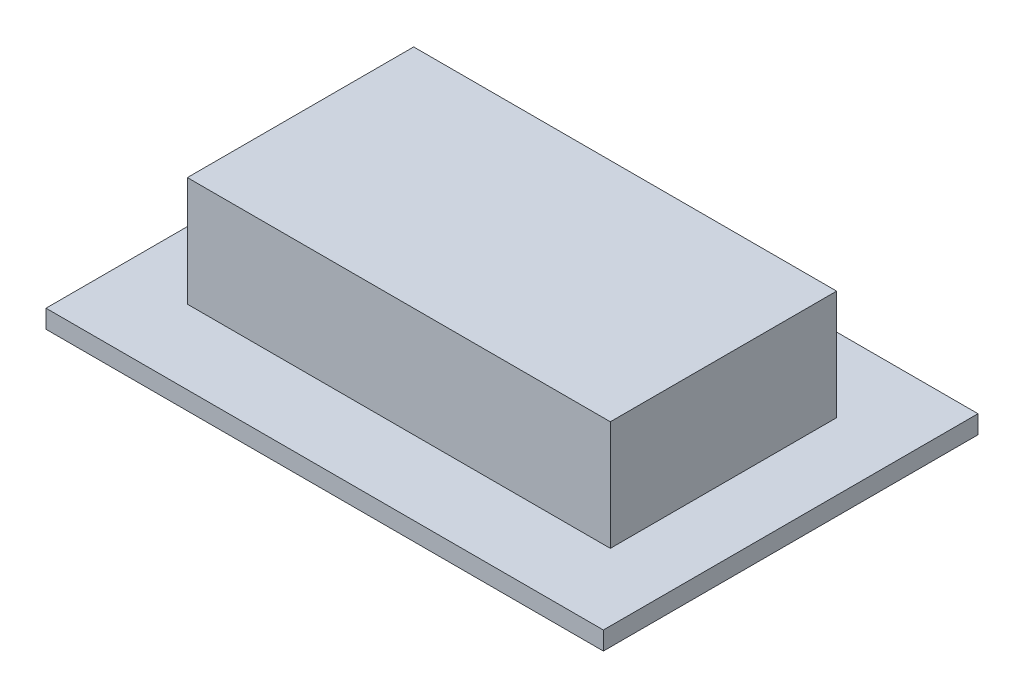
from build123d import *

# Parameters (mm, degrees)
SKETCH1_W           = 61
SKETCH1_H           = 41
BOSS_EXTRUDE1_DEPTH = 2
SKETCH2_W           = 46.288327706
SKETCH2_H           = 24.767077782
BOSS_EXTRUDE2_DEPTH = 12
SKETCH3_W           = 20.528597362
SKETCH3_H           = 14.9402222
BOSS_EXTRUDE3_DEPTH = 12


with BuildPart() as part:
    # Sketch1 → Boss-Extrude1 (new body)
    with BuildSketch(Plane(origin=(0, 0, 0), x_dir=(1, 0, 0), z_dir=(0, 1, 0))):
        Rectangle(SKETCH1_W, SKETCH1_H)
    extrude(amount=BOSS_EXTRUDE1_DEPTH)

    # Sketch2 → Boss-Extrude2 (add)
    with BuildSketch(Plane(origin=(0, 2, 0), x_dir=(1, 0, 0), z_dir=(0, 1, 0))):
        Rectangle(SKETCH2_W, SKETCH2_H)
    extrude(amount=BOSS_EXTRUDE2_DEPTH)

    # Sketch3 → Boss-Extrude3 (add)
    with BuildSketch(Plane.XZ):
        Rectangle(SKETCH3_W, SKETCH3_H)
    extrude(amount=BOSS_EXTRUDE3_DEPTH)


solid = part.part
